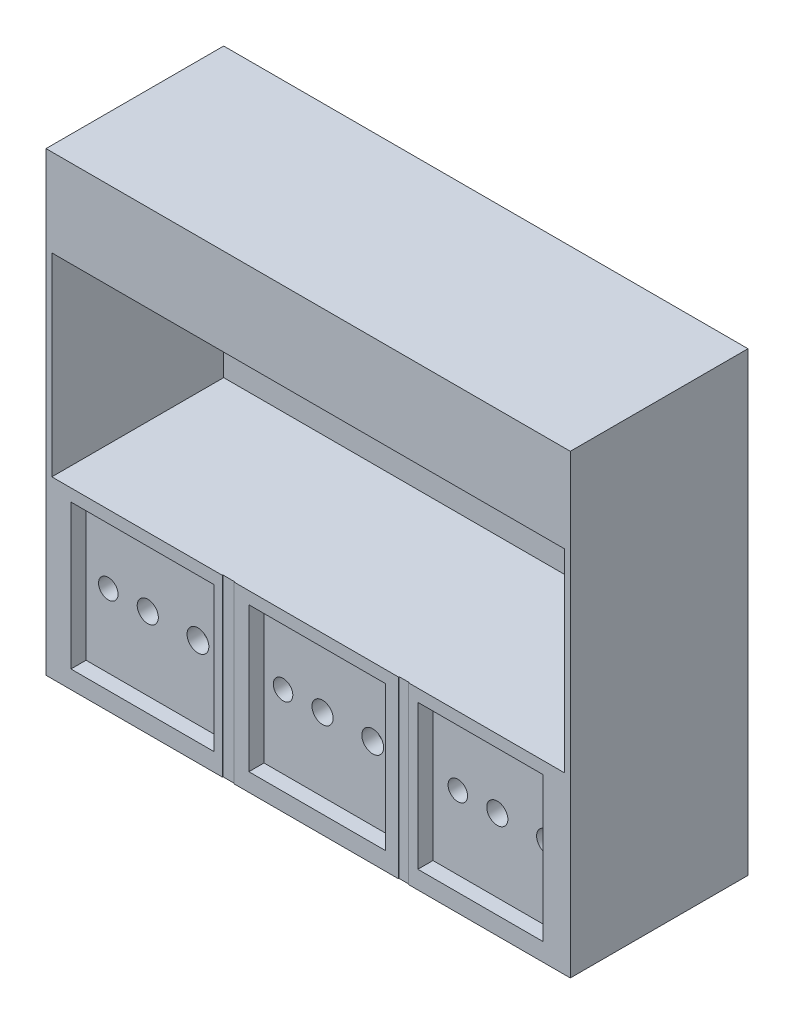
from build123d import *

# Parameters (mm, degrees)
CROQUIS1_W              = 1800
CROQUIS1_H              = 610
SALIENTE_EXTRUIR1_DEPTH = 600
CROQUIS2_W              = 40.721486725
CROQUIS2_H              = 600
CROQUIS2_W_2            = 34.613400616
CORTAR_EXTRUIR1_DEPTH   = 2
CROQUIS3_W              = 490.887470824
CROQUIS3_H              = 496.465737538
CROQUIS3_W_2            = 468.574403969
CROQUIS3_W_3            = 429.526536971
CORTAR_EXTRUIR2_DEPTH   = 52
CROQUIS4_R              = 33.469600283
CROQUIS4_R_2            = 36.25873364
CROQUIS4_R_3            = 37.420150707
CORTAR_EXTRUIR3_DEPTH   = 52
MATRIZL1_COUNT          = 3
MATRIZL1_PITCH          = 600
SALIENTE_EXTRUIR2_DEPTH = 666
CROQUIS6_W              = 1800
CROQUIS6_H              = 610
SALIENTE_EXTRUIR3_DEPTH = 300


with BuildPart() as part:
    # Croquis1 → Saliente-Extruir1 (new body)
    with BuildSketch(Plane(origin=(0, 0, 0), x_dir=(1, 0, 0), z_dir=(0, 1, 0))):
        Rectangle(CROQUIS1_W, CROQUIS1_H)
    extrude(amount=SALIENTE_EXTRUIR1_DEPTH)

    # Croquis2 → Cortar-Extruir1 (cut)
    with BuildSketch(Plane.XY.offset(305)):
        with Locations((-274.287558023, 300)):
            Rectangle(CROQUIS2_W, CROQUIS2_H)
        with Locations((327.607420408, 300)):
            Rectangle(CROQUIS2_W_2, CROQUIS2_H)
    extrude(amount=-CORTAR_EXTRUIR1_DEPTH, mode=Mode.SUBTRACT)

    # Croquis3 → Cortar-Extruir2 (cut)
    with BuildSketch(Plane.XY.offset(305)):
        with Locations((-568.983204819, 309.761966749)):
            Rectangle(CROQUIS3_W, CROQUIS3_H)
        with Locations((30.680466927, 309.761966749)):
            Rectangle(CROQUIS3_W_2, CROQUIS3_H)
        with Locations((591.296271675, 309.761966749)):
            Rectangle(CROQUIS3_W_3, CROQUIS3_H)
    extrude(amount=-CORTAR_EXTRUIR2_DEPTH, mode=Mode.SUBTRACT)

    # Croquis4 → Cortar-Extruir3 (cut)
    with BuildSketch(Plane.XY.offset(253)):
        with Locations((-738.199956824, 312.551100106)):
            Circle(CROQUIS4_R)
        with Locations((-602.642790268, 312.551100106)):
            Circle(CROQUIS4_R_2)
        with Locations((-430.405449232, 312.551100106)):
            Circle(CROQUIS4_R_3)
    cortar_extruir3 = extrude(amount=-CORTAR_EXTRUIR3_DEPTH, mode=Mode.SUBTRACT)

    # MatrizL1: Cortar-Extruir3 ×3
    with Locations(*[(i * MATRIZL1_PITCH, 0, 0) for i in range(1, MATRIZL1_COUNT)]):
        add(cortar_extruir3, mode=Mode.SUBTRACT)

    # Croquis5 → Saliente-Extruir2 (add)
    with BuildSketch(Plane(origin=(0, 600, 0), x_dir=(1, 0, 0), z_dir=(0, 1, 0))):
        Polygon((900, -305), (880, -305), (880, -285), (880, 285), (-880, 285), (-880, -285), (-880, -305), (-900, -305), (-900, 305), (900, 305), align=None)
    extrude(amount=SALIENTE_EXTRUIR2_DEPTH)

    # Croquis6 → Saliente-Extruir3 (add)
    with BuildSketch(Plane(origin=(0, 1266, 0), x_dir=(1, 0, 0), z_dir=(0, 1, 0))):
        Rectangle(CROQUIS6_W, CROQUIS6_H)
    extrude(amount=SALIENTE_EXTRUIR3_DEPTH)


solid = part.part
